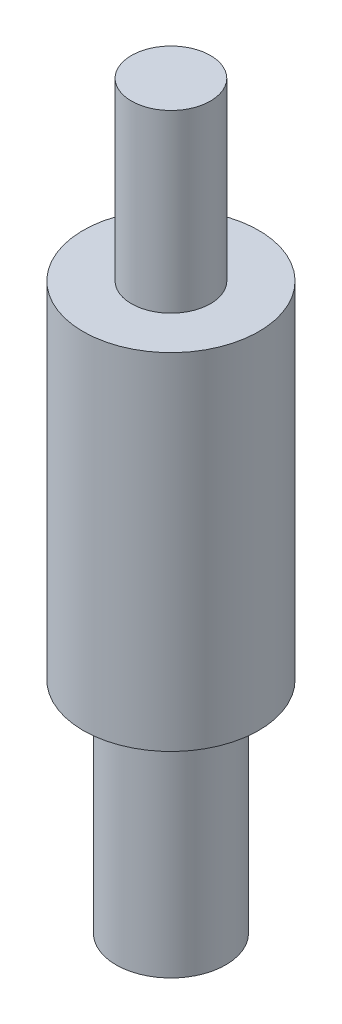
from build123d import *

# Parameters (mm, degrees)
SKETCH1_R           = 1.25
BOSS_EXTRUDE1_DEPTH = 5
SKETCH2_R           = 2
BOSS_EXTRUDE2_DEPTH = 7.87
SKETCH3_R           = 0.9
BOSS_EXTRUDE3_DEPTH = 4


with BuildPart() as part:
    # Sketch1 → Boss-Extrude1 (new body)
    with BuildSketch(Plane(origin=(0, 0, 0), x_dir=(1, 0, 0), z_dir=(0, 1, 0))):
        with Locations(Location((0, 0, 0), (0, 0, 270))):
            Circle(SKETCH1_R)
    extrude(amount=BOSS_EXTRUDE1_DEPTH)

    # Sketch2 → Boss-Extrude2 (add)
    with BuildSketch(Plane(origin=(0, 5, 0), x_dir=(1, 0, 0), z_dir=(0, 1, 0))):
        with Locations(Location((0, 0, 0), (0, 0, 270))):
            Circle(SKETCH2_R)
    extrude(amount=BOSS_EXTRUDE2_DEPTH)

    # Sketch3 → Boss-Extrude3 (add)
    with BuildSketch(Plane(origin=(0, 12.87, 0), x_dir=(1, 0, 0), z_dir=(0, 1, 0))):
        with Locations(Location((0, 0, 0), (0, 0, 270))):
            Circle(SKETCH3_R)
    extrude(amount=BOSS_EXTRUDE3_DEPTH)


solid = part.part
